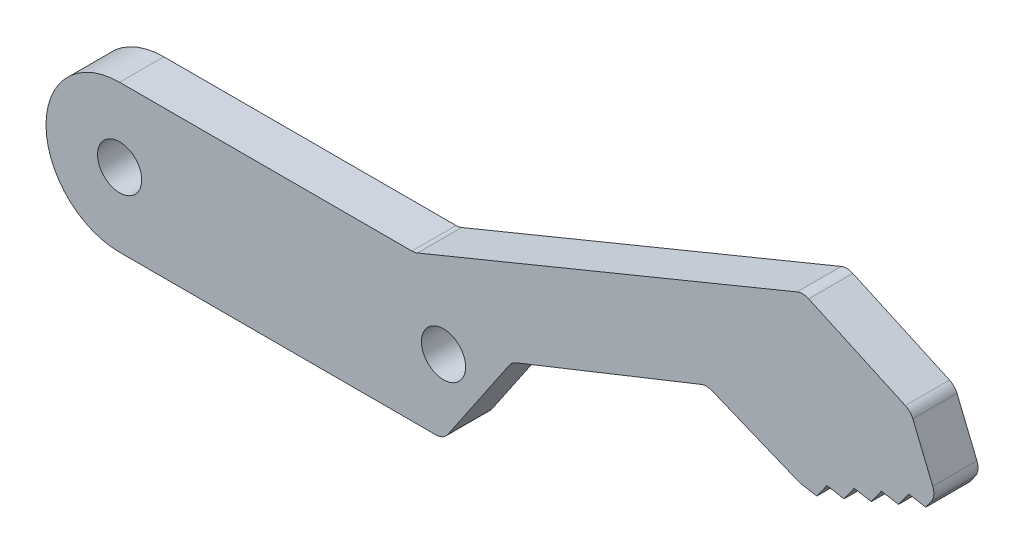
from build123d import *

# Parameters (mm, degrees)
SKETCH1_R           = 1.5
BOSS_EXTRUDE1_DEPTH = 3
FILLET1_R           = 1


with BuildPart() as part:
    # Sketch1 → Boss-Extrude1 (new body)
    # profile 1 of 2: a face of its own
    with BuildSketch(Plane.XY):
        with BuildLine():
            Line((20.05, 5), (0, 5))
            ThreePointArc((0, 5), (-5, 0), (0, -5))
            Line((0, -5), (22, -5))
            Line((22, -5), (26.644435765, 1.851814361))
            ThreePointArc((26.644435765, 1.851814361), (24.805434743, 4.138784351), (22, 5))
            Line((22, 5), (20.05, 5))
        make_face()
        Circle(SKETCH1_R, mode=Mode.SUBTRACT)
        with Locations((22, 0)):
            Circle(SKETCH1_R, mode=Mode.SUBTRACT)
    # profile 2 of 2: a face of its own
    with BuildSketch(Plane.XY):
        with BuildLine():
            Line((46.409029503, 15.837507263), (20.05, 5))
            Line((20.05, 5), (22, 5))
            ThreePointArc((22, 5), (24.805434743, 4.138784351), (26.644435765, 1.851814361))
            Line((26.644435765, 1.851814361), (39.871788822, 7.125781662))
            Line((39.871788822, 7.125781662), (46.188488025, 4.540007042))
            Line((46.188488025, 4.540007042), (47.352932204, 4.337597171))
            Line((47.352932204, 4.337597171), (48.038244482, 5.300533868))
            Line((48.038244482, 5.300533868), (49.20268866, 5.098123997))
            Line((49.20268866, 5.098123997), (49.888000938, 6.061060693))
            Line((49.888000938, 6.061060693), (51.052445116, 5.858650822))
            Line((51.052445116, 5.858650822), (51.737757394, 6.821587519))
            Line((51.737757394, 6.821587519), (52.902201573, 6.619177648))
            Line((52.902201573, 6.619177648), (53.587513851, 7.582114344))
            Line((53.587513851, 7.582114344), (54.751958029, 7.379704473))
            Line((54.751958029, 7.379704473), (55.437270307, 8.34264117))
            Line((55.437270307, 8.34264117), (53.72608495, 12.504593197))
            Line((53.72608495, 12.504593197), (46.409029503, 15.837507263))
        make_face()
    extrude(amount=BOSS_EXTRUDE1_DEPTH)

    # Fillet1
    fillet1_edges = [part.edges().sort_by_distance(p)[0] for p in [
        (22, -5, 1.5),
        (20.05, 5, 1.5),
        (46.409029503, 15.837507263, 1.5),
        (53.72608495, 12.504593197, 1.5),
        (55.437270307, 8.34264117, 1.5),
        (46.188488025, 4.540007042, 1.5),
        (39.871788822, 7.125781662, 1.5),
        (26.644435765, 1.851814361, 1.5),
    ]]
    fillet(fillet1_edges, radius=FILLET1_R)


solid = part.part
